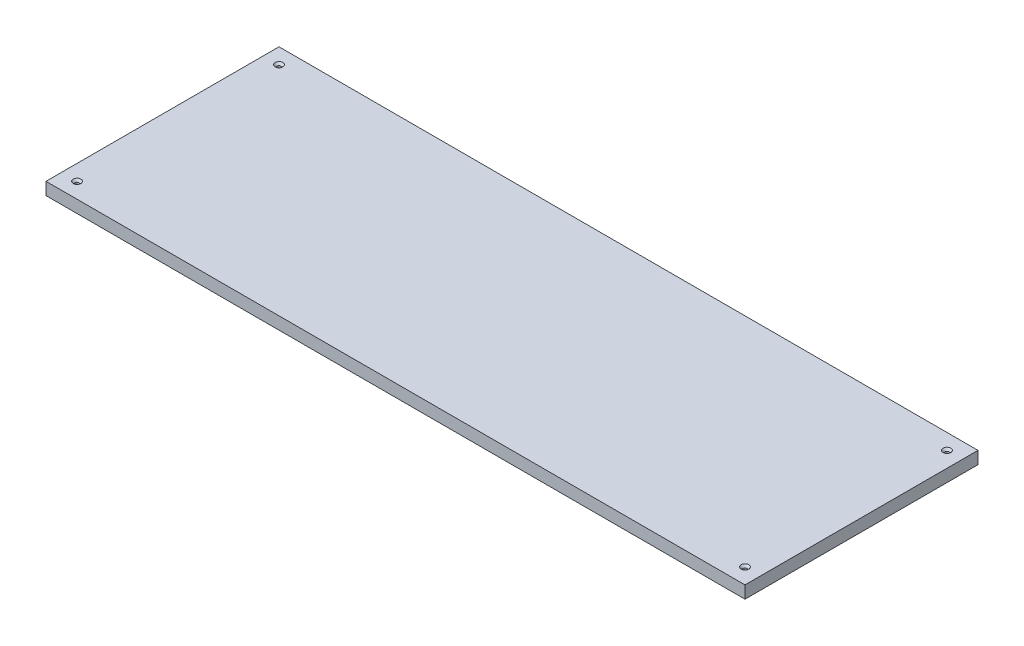
from build123d import *

# Parameters (mm, degrees)
SKETCH_2_W                  = 900
SKETCH_2_H                  = 300
EXTRUDE_1_DEPTH             = 16
CSK_M4_1_D                  = 4.5
CSK_M4_1_CSINK_D            = 9.9
CSK_M4_1_CSINK_ANGLE        = 92
PATTERN_LINEAR_1_COUNT      = 2
PATTERN_LINEAR_1_PITCH      = 860
PATTERN_LINEAR_1_COUNT_DIR2 = 2
PATTERN_LINEAR_1_PITCH_DIR2 = 260


with BuildPart() as part:
    # Эскиз2 → Бобышка-Вытянуть1 (new body)
    with BuildSketch(Plane(origin=(0, 0, 0), x_dir=(1, 0, 0), z_dir=(0, 1, 0))):
        Rectangle(SKETCH_2_W, SKETCH_2_H)
    extrude(amount=EXTRUDE_1_DEPTH)

    # CSK для M4 винта с полупотайной головкой и крестообразным шлицем1 (through all)
    with Locations(Plane(origin=(-430, 16, -130), x_dir=(0, 0, 1), z_dir=(0, 1, 0))):
        with Locations((0, 0)):
            csk_m4_1 = CounterSinkHole(CSK_M4_1_D / 2, CSK_M4_1_CSINK_D / 2, counter_sink_angle=CSK_M4_1_CSINK_ANGLE)

    # Линейный массив1: CSK _ M4 _ _ _ _ _ _ _1 2 × 2
    with Locations(*[(i * PATTERN_LINEAR_1_PITCH, 0, j * PATTERN_LINEAR_1_PITCH_DIR2) for i in range(PATTERN_LINEAR_1_COUNT) for j in range(PATTERN_LINEAR_1_COUNT_DIR2) if (i, j) != (0, 0)]):
        add(csk_m4_1, mode=Mode.SUBTRACT)


solid = part.part
